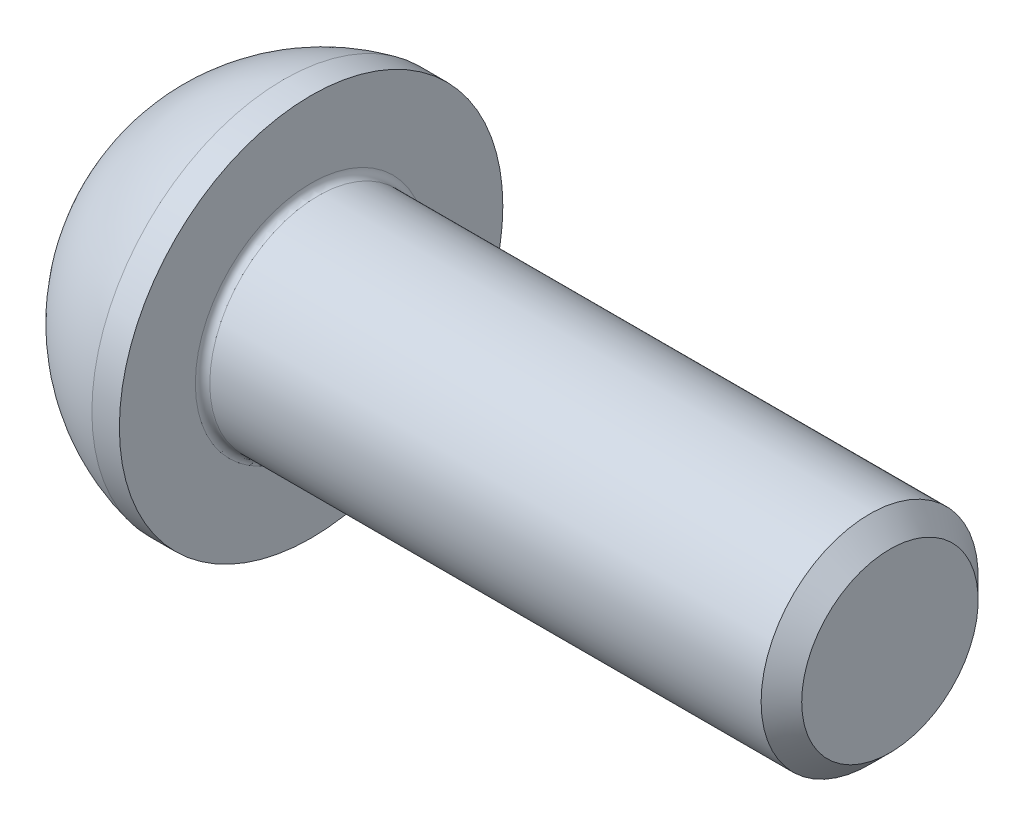
from build123d import *

# Parameters (mm, degrees)
FILLET1_R   = 0.1
HEX_2_DEPTH = 1.04


with BuildPart() as part:
    # BodySke → BaseBody (revolve)
    with BuildSketch(Plane.XY, mode=Mode.PRIVATE) as basebody_sk:
        with BuildLine():
            Line((10.2, 0), (10.2, 1.2195))
            Line((10.2, 1.2195), (9.9195, 1.5))
            Line((9.9195, 1.5), (2.2, 1.5))
            Line((2.2, 1.5), (2.2, 2.65))
            Line((2.2, 2.65), (1.82, 2.65))
            ThreePointArc((1.82, 2.65), (0.765544213, 2.185922288), (0, 1.325))
            Line((0, 1.325), (0, 0))
            Line((0, 0), (10.2, 0))
        make_face()
    revolve(basebody_sk.sketch.rotate(Axis((0, 0, 0), (1, 0, 0)), 90), axis=Axis((0, 0, 0), (1, 0, 0)))

    # Fillet1
    fillet1_edges = [part.edges().sort_by_distance(p)[0] for p in [
        (2.2, 0, -1.5),
    ]]
    fillet(fillet1_edges, radius=FILLET1_R)

    # Sketch2 → PreBroach (revolve, cut)
    with BuildSketch(Plane.XY, mode=Mode.PRIVATE) as prebroach_sk:
        Polygon((0, 1), (1.04, 1), (1.617350269, 0), (0, 0), align=None)
    revolve(prebroach_sk.sketch.rotate(Axis((0, 0, 0), (1, 0, 0)), 90), axis=Axis((0, 0, 0), (1, 0, 0)), mode=Mode.SUBTRACT)

    # Sketch3 → Hex 2 (cut)
    with BuildSketch(Plane(origin=(0, 0, 0), x_dir=(0, 0, -1), z_dir=(1, 0, 0))):
        Polygon((-1, -0.577350269), (-1, 0.577350269), (0, 1.154700538), (1, 0.577350269), (1, -0.577350269), (0, -1.154700538), align=None)
    extrude(amount=HEX_2_DEPTH, mode=Mode.SUBTRACT)


solid = part.part
